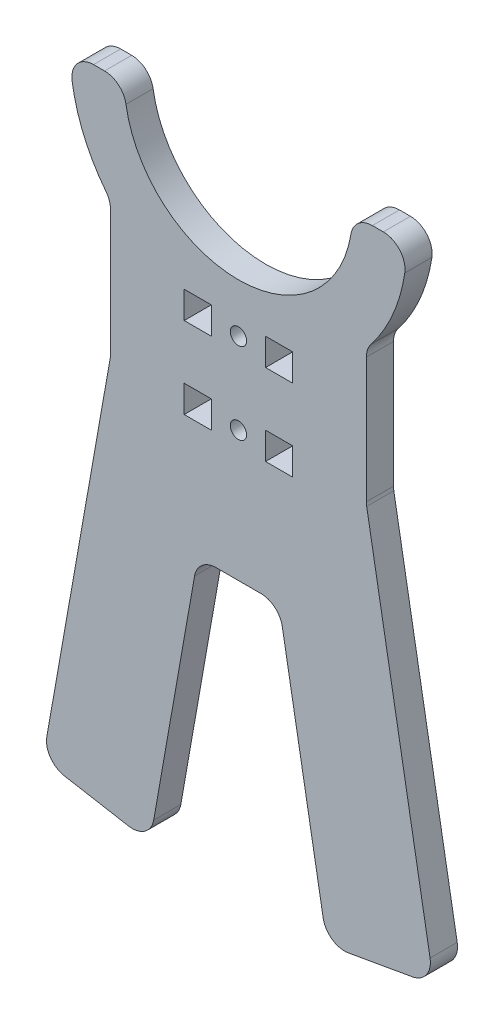
from build123d import *

# Parameters (mm, degrees)
SKETCH1_R           = 1.5
SKETCH1_W           = 5
SKETCH1_H           = 5
BOSS_EXTRUDE1_DEPTH = 5
FILLET1_R           = 4


with BuildPart() as part:
    # Sketch1 → Boss-Extrude1 (new body)
    with BuildSketch(Plane.XY):
        with BuildLine():
            Line((-21, 45), (-31, 45))
            ThreePointArc((-31, 45), (-29.085023859, 34.273332897), (-23.576684701, 24.871911702))
            Line((-23.576684701, 24.871911702), (-23.576684701, 0))
            Line((-23.576684701, 0), (-36.012504096, -70.527036447))
            Line((-36.012504096, -70.527036447), (-16.316349035, -74))
            Line((-16.316349035, -74), (-7.5, -24))
            Line((-7.5, -24), (7.5, -24))
            Line((7.5, -24), (16.316349035, -74))
            Line((16.316349035, -74), (36.012504096, -70.527036447))
            Line((36.012504096, -70.527036447), (23.576684701, 0))
            Line((23.576684701, 0), (23.576684701, 24.871911702))
            ThreePointArc((23.576684701, 24.871911702), (29.085023859, 34.273332897), (31, 45))
            Line((31, 45), (21, 45))
            ThreePointArc((21, 45), (0, 24), (-21, 45))
        make_face()
        Circle(SKETCH1_R, mode=Mode.SUBTRACT)
        with Locations((0, 15)):
            Circle(SKETCH1_R, mode=Mode.SUBTRACT)
        with Locations((-7.5, 0)):
            Rectangle(SKETCH1_W, SKETCH1_H, mode=Mode.SUBTRACT)
        with Locations((7.5, 0)):
            Rectangle(SKETCH1_W, SKETCH1_H, mode=Mode.SUBTRACT)
        with Locations((-7.5, 15)):
            Rectangle(SKETCH1_W, SKETCH1_H, mode=Mode.SUBTRACT)
        with Locations((7.5, 15)):
            Rectangle(SKETCH1_W, SKETCH1_H, mode=Mode.SUBTRACT)
    extrude(amount=BOSS_EXTRUDE1_DEPTH)

    # Fillet1
    fillet1_edges = [part.edges().sort_by_distance(p)[0] for p in [
        (21, 45, 2.5),
        (31, 45, 2.5),
        (23.576684701, 24.871911702, 2.5),
        (23.576684701, 0, 2.5),
        (36.012504096, -70.527036447, 2.5),
        (16.316349035, -74, 2.5),
        (7.5, -24, 2.5),
        (-7.5, -24, 2.5),
        (-16.316349035, -74, 2.5),
        (-36.012504096, -70.527036447, 2.5),
        (-23.576684701, 0, 2.5),
        (-23.576684701, 24.871911702, 2.5),
        (-31, 45, 2.5),
        (-21, 45, 2.5),
    ]]
    fillet(fillet1_edges, radius=FILLET1_R)


solid = part.part
